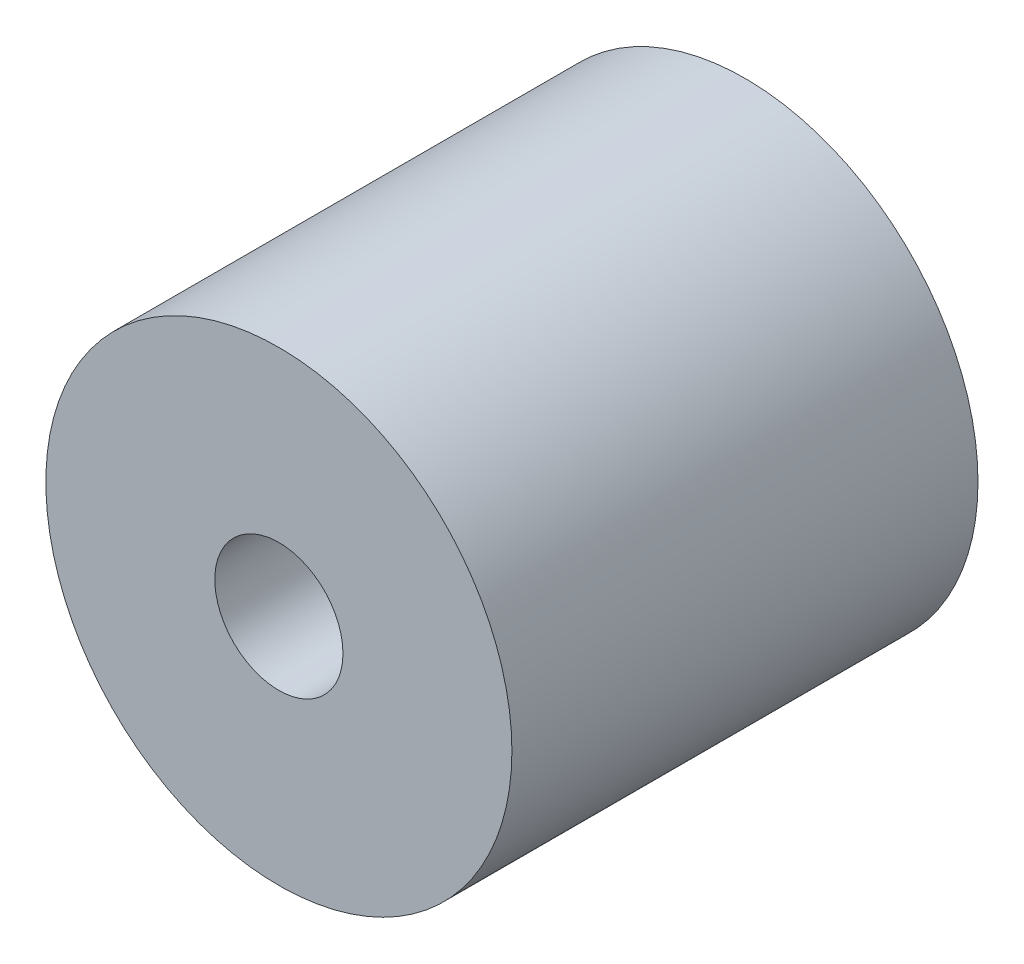
from build123d import *

# Parameters (mm, degrees)
SKETCH_1_R      = 4
SKETCH_1_R_2    = 1.1
EXTRUDE_1_DEPTH = 8


with BuildPart() as part:
    # 草图1 → 凸台-拉伸1 (new body)
    with BuildSketch(Plane.XY):
        Circle(SKETCH_1_R)
        Circle(SKETCH_1_R_2, mode=Mode.SUBTRACT)
    extrude(amount=EXTRUDE_1_DEPTH)


solid = part.part
